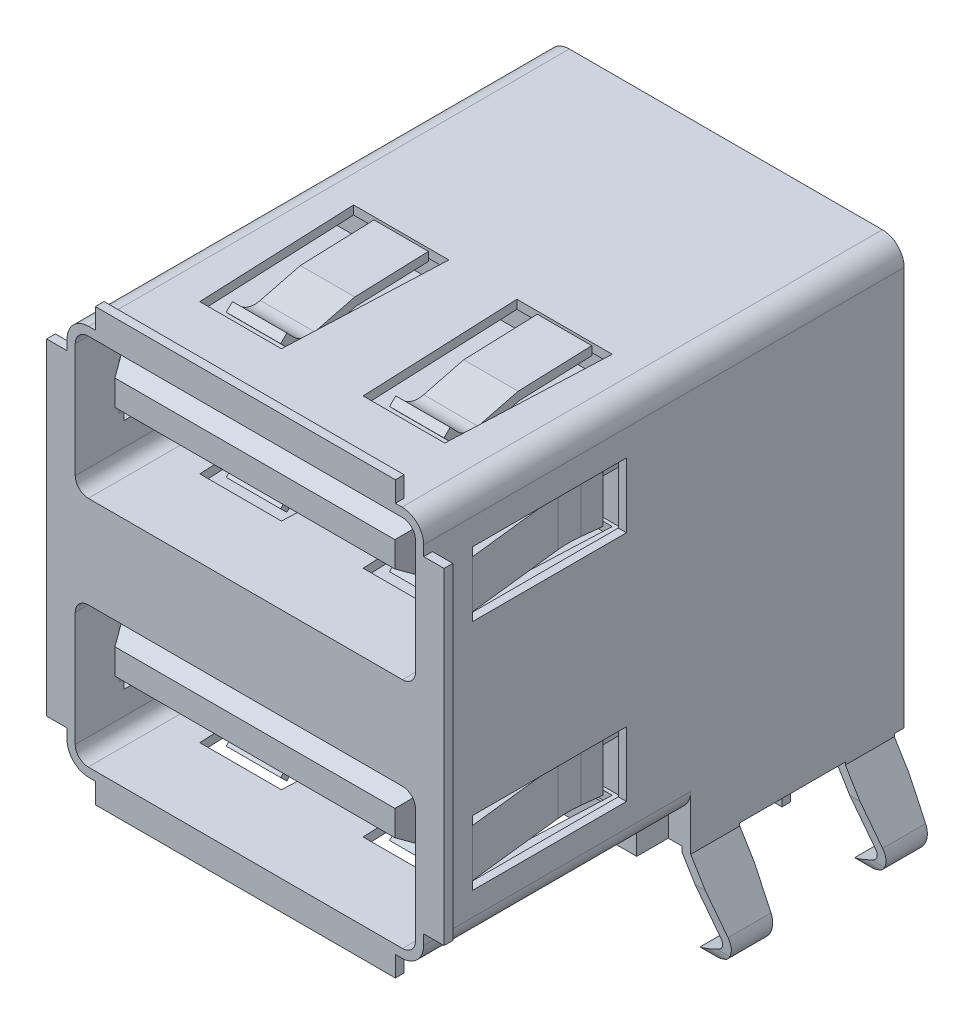
from build123d import *
from OCP.BRepFilletAPI import BRepFilletAPI_MakeChamfer

# Parameters (mm, degrees)
SKETCH1_W                                      = 13.1
SKETCH1_H                                      = 17.65
BASE_DEPTH                                     = 14.35
SKETCH3_W                                      = 11.02
SKETCH3_H                                      = 0.75
SKETCH3_W_2                                    = 0.75
SKETCH3_H_2                                    = 12
FRONT_TABS_DEPTH                               = 0.32
CORNER_FILLETS_R                               = 0.8
D_BACK_STEP_DEPTH                              = 7.84
SKETCH19_W                                     = 11.45
SKETCH19_H                                     = 1.16
D_BOTTOM_STEP_DEPTH                            = 1.1
GROUND_TAIL_1_DEPTH                            = 0.9
GROUND_TAIL_1_SHAPE_DEPTH                      = 8
GROUND_TAIL_PATTERN_COUNT                      = 2
GROUND_TAIL_PATTERN_PITCH                      = 5.68
SKETCH23_W                                     = 0.6604
SKETCH23_H                                     = 0.31
TH_CONTACT_TAIL_DEPTH                          = 4.1
TH_CONTACT_PATTERN_COUNT                       = 2
TH_CONTACT_PATTERN_PITCH                       = 2.62
CONTACT_AREA_CUTOUT_DEPTH                      = 8.85
TOP_BOTTOM_FLANGE_CUTOUT_DEPTH                 = 5.8
TOP_BOTTOM_FLANGE_DEPTH                        = 1
TOP_BOTTOM_FLANGE_PATTERN_COUNT                = 2
TOP_BOTTOM_FLANGE_PATTERN_PITCH                = 6
SKETCH14_W                                     = 5.65
SKETCH14_H                                     = 2.38
SIDE_FLANGE_CUTOUT_DEPTH                       = 23.686849228
SIDE_FLANGE_DEPTH                              = 0.875
SKETCH16_W                                     = 11.15
SKETCH16_H                                     = 1.8
CONTACT_GUIDE_DEPTH                            = 8.5
CONTACT_GUIDE_LEAD_IN_SIZE                     = 0.75
CONTACT_GUIDE_LEAD_IN_SIZE2                    = 0.433012702
CONTACT_DEPTH                                  = 0.33
CONTACT_PATTERN_COUNT                          = 2
CONTACT_PATTERN_PITCH                          = 2.5
CONTACT_PATTERN_MIRROR_COPY_1_DEPTH            = 0.33
TOP_USB_PATTERN_COUNT                          = 2
TOP_USB_PATTERN_PITCH                          = 8.55
TOP_USB_PATTERN_COPY_1_DEPTH                   = 1
TOP_USB_PATTERN_COPY_2_DEPTH                   = 0.33
TOP_USB_PATTERN_COPY_3_DEPTH                   = 0.33
TOP_USB_PATTERN_COPY_4_DEPTH                   = 0.33
CONTACT_GUIDE_LEAD_IN_OF_TOP_USB_PATTERN_SIZE  = 0.75
CONTACT_GUIDE_LEAD_IN_OF_TOP_USB_PATTERN_SIZE2 = 0.433012702


with BuildPart() as part:
    # Sketch1 → Base (new body)
    with BuildSketch(Plane(origin=(0, 0, 0), x_dir=(1, 0, 0), z_dir=(0, 1, 0))):
        Rectangle(SKETCH1_W, SKETCH1_H)
    extrude(amount=BASE_DEPTH)

    # Sketch3 → Front Tabs (add)
    with BuildSketch(Plane.XY.offset(8.825)):
        with Locations((0, 14.725)):
            Rectangle(SKETCH3_W, SKETCH3_H)
        with Locations((6.925, 7.175)):
            Rectangle(SKETCH3_W_2, SKETCH3_H_2)
        with Locations((0, -0.375)):
            Rectangle(SKETCH3_W, SKETCH3_H)
        with Locations((-6.925, 7.175)):
            Rectangle(SKETCH3_W_2, SKETCH3_H_2)
    extrude(amount=-FRONT_TABS_DEPTH)

    # Corner Fillets
    corner_fillets_edges = [part.edges().sort_by_distance(p)[0] for p in [
        (-6.55, 14.35, 0),
        (-6.55, 0, 0),
        (6.55, 0, 0),
        (6.55, 14.35, 0),
    ]]
    fillet(corner_fillets_edges, radius=CORNER_FILLETS_R)

    # Sketch18 → -D Back Step (add)
    with BuildSketch(Plane(origin=(0, 0, -8.825), x_dir=(-1, 0, 0), z_dir=(0, 0, -1))):
        with BuildLine():
            Line((-6.55, 0.8), (-6.55, -1.1))
            Line((-6.55, -1.1), (6.55, -1.1))
            Line((6.55, -1.1), (6.55, 0.8))
            ThreePointArc((6.55, 0.8), (6.315685425, 0.234314575), (5.75, 0))
            Line((5.75, 0), (-5.75, 0))
            ThreePointArc((-5.75, 0), (-6.315685425, 0.234314575), (-6.55, 0.8))
        make_face()
    extrude(amount=-D_BACK_STEP_DEPTH)

    # Sketch19 → -D Bottom Step (add)
    with BuildSketch(Plane.XZ):
        with Locations((0, -0.405)):
            Rectangle(SKETCH19_W, SKETCH19_H)
    extrude(amount=D_BOTTOM_STEP_DEPTH)

    # Sketch10 → Ground Tail 1 (add, symmetric)
    with BuildSketch(Plane.XY.offset(-1.885)):
        with BuildLine():
            Line((6.55, -1.2), (6.55, -1.1))
            Line((6.55, -1.1), (6.23, -1.1))
            Line((6.23, -1.1), (6.23, -1.289427281))
            Line((6.23, -1.289427281), (7.53653566, -3.444470404))
            ThreePointArc((7.53653566, -3.444470404), (7.568809506, -3.681173083), (7.417946806, -3.866403226))
            Line((7.417946806, -3.866403226), (6.55, -4.315836559))
            Line((6.55, -4.315836559), (6.69714326, -4.6))
            Line((6.69714326, -4.6), (7.565090066, -4.150566667))
            ThreePointArc((7.565090066, -4.150566667), (7.876872978, -3.767757706), (7.810173696, -3.278572167))
            Line((7.810173696, -3.278572167), (6.55, -1.2))
        make_face()
        with BuildLine():
            Line((-6.55, -1.1), (-6.23, -1.1))
            Line((-6.23, -1.1), (-6.23, -1.289427281))
            Line((-6.23, -1.289427281), (-7.53653566, -3.444470404))
            ThreePointArc((-7.53653566, -3.444470404), (-7.568809506, -3.681173083), (-7.417946806, -3.866403226))
            Line((-7.417946806, -3.866403226), (-6.55, -4.315836559))
            Line((-6.55, -4.315836559), (-6.69714326, -4.6))
            Line((-6.69714326, -4.6), (-7.565090066, -4.150566667))
            ThreePointArc((-7.565090066, -4.150566667), (-7.876872978, -3.767757706), (-7.810173696, -3.278572167))
            Line((-7.810173696, -3.278572167), (-6.55, -1.2))
            Line((-6.55, -1.2), (-6.55, -1.1))
        make_face()
    ground_tail_1 = extrude(amount=GROUND_TAIL_1_DEPTH, both=True)

    # Sketch11 → Ground Tail 1 Shape (cut, symmetric)
    with BuildSketch(Plane(origin=(0, 0, 0), x_dir=(0, 0, -1), z_dir=(1, 0, 0))):
        with BuildLine():
            Line((0.96, -1.809071665), (1.153297835, -3.906504778))
            ThreePointArc((1.153297835, -3.906504778), (1.885, -4.573874551), (2.616702165, -3.906504778))
            Line((2.616702165, -3.906504778), (2.81, -1.809071665))
            Line((2.81, -1.809071665), (2.81, -4.939071665))
            Line((2.81, -4.939071665), (0.96, -4.939071665))
            Line((0.96, -4.939071665), (0.96, -1.809071665))
        make_face()
    ground_tail_1_shape = extrude(amount=GROUND_TAIL_1_SHAPE_DEPTH, both=True, mode=Mode.SUBTRACT)

    # Ground Tail Pattern: Ground Tail 1, Ground Tail 1 Shape ×2
    with Locations(*[(0, 0, -i * GROUND_TAIL_PATTERN_PITCH) for i in range(1, GROUND_TAIL_PATTERN_COUNT)]):
        add(ground_tail_1)
        add(ground_tail_1_shape, mode=Mode.SUBTRACT)

    # Sketch23 → -TH Contact Tail (add)
    with BuildSketch(Plane.XZ):
        with Locations((-3.5098, -4.6028)):
            Rectangle(SKETCH23_W, SKETCH23_H)
        with Locations((3.4902, -4.6028)):
            Rectangle(SKETCH23_W, SKETCH23_H)
        with Locations((-1.0098, -4.6028)):
            Rectangle(SKETCH23_W, SKETCH23_H)
        with Locations((0.9902, -4.6028)):
            Rectangle(SKETCH23_W, SKETCH23_H)
    th_contact_tail = extrude(amount=TH_CONTACT_TAIL_DEPTH)

    # -TH Contact Pattern: -TH Contact Tail ×2
    with Locations(*[(0, 0, -i * TH_CONTACT_PATTERN_PITCH) for i in range(1, TH_CONTACT_PATTERN_COUNT)]):
        add(th_contact_tail)

    # Sketch8 → Contact Area Cutout (cut)
    with BuildSketch(Plane.XY.offset(8.825)):
        with BuildLine():
            Line((-6.25, 5), (-6.25, 0.8))
            ThreePointArc((-6.25, 0.8), (-6.109411255, 0.460588745), (-5.77, 0.32))
            Line((-5.77, 0.32), (5.77, 0.32))
            ThreePointArc((5.77, 0.32), (6.109411255, 0.460588745), (6.25, 0.8))
            Line((6.25, 0.8), (6.25, 5))
            ThreePointArc((6.25, 5), (6.109411255, 5.339411255), (5.77, 5.48))
            Line((5.77, 5.48), (-5.77, 5.48))
            ThreePointArc((-5.77, 5.48), (-6.109411255, 5.339411255), (-6.25, 5))
        make_face()
    contact_area_cutout = extrude(amount=-CONTACT_AREA_CUTOUT_DEPTH, mode=Mode.SUBTRACT)

    # Sketch12 → Top/Bottom Flange Cutout (cut)
    with BuildSketch(Plane(origin=(0, 0, 0), x_dir=(-1, 0, 0), z_dir=(0, 1, 0))):
        Polygon((4.5, 6), (4.75, 0.1), (1.25, 0.1), (1.5, 6), align=None)
        Polygon((-4.75, 0.1), (-1.25, 0.1), (-1.5, 6), (-4.5, 6), align=None)
    top_bottom_flange_cutout = extrude(amount=TOP_BOTTOM_FLANGE_CUTOUT_DEPTH, mode=Mode.SUBTRACT)

    # Sketch13 → Top/Bottom Flange (add, symmetric)
    with BuildSketch(Plane(origin=(-3, 0, 0), x_dir=(0, 0, -1), z_dir=(1, 0, 0))):
        with BuildLine():
            Line((-2.760063847, 0.417489088), (-4.198269078, 0.784212886))
            ThreePointArc((-4.198269078, 0.784212886), (-4.778069903, 0.777154214), (-5.276638422, 0.481099735))
            Line((-5.276638422, 0.481099735), (-5.529039549, 0.222413302))
            Line((-5.529039549, 0.222413302), (-5.3, -0.001061272))
            Line((-5.3, -0.001061272), (-5.047598873, 0.257625162))
            ThreePointArc((-5.047598873, 0.257625162), (-4.691478502, 0.469092647), (-4.277335056, 0.474134555))
            Line((-4.277335056, 0.474134555), (-2.8059045, 0.098938728))
            Line((-2.8059045, 0.098938728), (-0.1, 0.001))
            Line((-0.1, 0.001), (-0.1, 0.321209538))
            Line((-0.1, 0.321209538), (-2.760063847, 0.417489088))
        make_face()
        with BuildLine():
            Line((-2.8059045, 5.601061272), (-4.277335056, 5.225865445))
            ThreePointArc((-4.277335056, 5.225865445), (-4.691478502, 5.230907353), (-5.047598873, 5.442374838))
            Line((-5.047598873, 5.442374838), (-5.3, 5.701061272))
            Line((-5.3, 5.701061272), (-5.529039549, 5.477586698))
            Line((-5.529039549, 5.477586698), (-5.276638422, 5.218900265))
            ThreePointArc((-5.276638422, 5.218900265), (-4.778069903, 4.922845786), (-4.198269078, 4.915787114))
            Line((-4.198269078, 4.915787114), (-2.760063847, 5.282510912))
            Line((-2.760063847, 5.282510912), (-0.1, 5.378790462))
            Line((-0.1, 5.378790462), (-0.1, 5.699))
            Line((-0.1, 5.699), (-2.8059045, 5.601061272))
        make_face()
    top_bottom_flange = extrude(amount=TOP_BOTTOM_FLANGE_DEPTH, both=True)

    # Top/Bottom Flange Pattern: Top/Bottom Flange ×2
    with Locations(*[(i * TOP_BOTTOM_FLANGE_PATTERN_PITCH, 0, 0) for i in range(1, TOP_BOTTOM_FLANGE_PATTERN_COUNT)]):
        add(top_bottom_flange)

    # Sketch14 → Side Flange Cutout (cut, through all)
    with BuildSketch(Plane(origin=(6.55, 0, 0), x_dir=(0, 0, -1), z_dir=(1, 0, 0))):
        with Locations((-4.2, 2.85)):
            Rectangle(SKETCH14_W, SKETCH14_H)
    side_flange_cutout = extrude(amount=-SIDE_FLANGE_CUTOUT_DEPTH, mode=Mode.SUBTRACT)

    # Sketch15 → Side Flange (add, symmetric)
    with BuildSketch(Plane(origin=(0, 2.85, 0), x_dir=(-1, 0, 0), z_dir=(0, 1, 0))):
        with BuildLine():
            Line((6.55, 7.025), (6.149012428, 3.498694006))
            ThreePointArc((6.149012428, 3.498694006), (6.125000079, 3.075770202), (6.148838699, 2.65283657))
            Line((6.148838699, 2.65283657), (6.231300503, 1.925))
            Line((6.231300503, 1.925), (5.913334739, 1.888975387))
            Line((5.913334739, 1.888975387), (5.830872935, 2.616811958))
            ThreePointArc((5.830872935, 2.616811958), (5.805000086, 3.075835926), (5.831061488, 3.534849227))
            Line((5.831061488, 3.534849227), (6.25, 7.219016737))
            Line((6.25, 7.219016737), (6.55, 7.025))
        make_face()
        with BuildLine():
            Line((-5.913334739, 1.888975387), (-6.231300503, 1.925))
            Line((-6.231300503, 1.925), (-6.148838699, 2.65283657))
            ThreePointArc((-6.148838699, 2.65283657), (-6.125000079, 3.075770202), (-6.149012428, 3.498694006))
            Line((-6.149012428, 3.498694006), (-6.55, 7.025))
            Line((-6.55, 7.025), (-6.25, 7.219016737))
            Line((-6.25, 7.219016737), (-5.831061488, 3.534849227))
            ThreePointArc((-5.831061488, 3.534849227), (-5.805000086, 3.075835926), (-5.830872935, 2.616811958))
            Line((-5.830872935, 2.616811958), (-5.913334739, 1.888975387))
        make_face()
    side_flange = extrude(amount=SIDE_FLANGE_DEPTH, both=True)

    # Sketch16 → Contact Guide (add)
    with BuildSketch(Plane.XY.offset(-0.025)):
        with Locations((0, 3.82)):
            Rectangle(SKETCH16_W, SKETCH16_H)
    contact_guide = extrude(amount=CONTACT_GUIDE_DEPTH)

    # Contact Guide Lead-in: one chamfer whose edges measure the first distance from different faces: ONE call of the kernel's chamfer builder (chamfer() names one face for all edges)
    contact_guide_lead_in_edges_1 = [part.edges().sort_by_distance(p)[0] for p in [
        (5.575, 3.82, 8.475),
    ]]
    contact_guide_lead_in_side_1 = [part.faces().sort_by_distance(p)[0] for p in [
        (5.575, 3.82, 4.225),
    ]]
    contact_guide_lead_in_edges_2 = [part.edges().sort_by_distance(p)[0] for p in [
        (0, 4.72, 8.475),
    ]]
    contact_guide_lead_in_side_2 = [part.faces().sort_by_distance(p)[0] for p in [
        (0, 4.72, 4.225),
    ]]
    contact_guide_lead_in_edges_3 = [part.edges().sort_by_distance(p)[0] for p in [
        (-5.575, 3.82, 8.475),
    ]]
    contact_guide_lead_in_side_3 = [part.faces().sort_by_distance(p)[0] for p in [
        (-5.575, 3.82, 4.225),
    ]]
    contact_guide_lead_in_edges_4 = [part.edges().sort_by_distance(p)[0] for p in [
        (0, 2.92, 8.475),
    ]]
    contact_guide_lead_in_side_4 = [part.faces().sort_by_distance(p)[0] for p in [
        (0, 2.92, 4.225),
    ]]
    contact_guide_lead_in = BRepFilletAPI_MakeChamfer(part.part.solid().wrapped)
    for e in contact_guide_lead_in_edges_1:
        contact_guide_lead_in.Add(CONTACT_GUIDE_LEAD_IN_SIZE, CONTACT_GUIDE_LEAD_IN_SIZE2, e.wrapped, contact_guide_lead_in_side_1[0].wrapped)  # the first distance lies on this face
    for e in contact_guide_lead_in_edges_2:
        contact_guide_lead_in.Add(CONTACT_GUIDE_LEAD_IN_SIZE, CONTACT_GUIDE_LEAD_IN_SIZE2, e.wrapped, contact_guide_lead_in_side_2[0].wrapped)  # the first distance lies on this face
    for e in contact_guide_lead_in_edges_3:
        contact_guide_lead_in.Add(CONTACT_GUIDE_LEAD_IN_SIZE, CONTACT_GUIDE_LEAD_IN_SIZE2, e.wrapped, contact_guide_lead_in_side_3[0].wrapped)  # the first distance lies on this face
    for e in contact_guide_lead_in_edges_4:
        contact_guide_lead_in.Add(CONTACT_GUIDE_LEAD_IN_SIZE, CONTACT_GUIDE_LEAD_IN_SIZE2, e.wrapped, contact_guide_lead_in_side_4[0].wrapped)  # the first distance lies on this face
    add(Compound.cast(contact_guide_lead_in.Shape()), mode=Mode.REPLACE)

    # Sketch17 → Contact (add, symmetric)
    with BuildSketch(Plane(origin=(-3.5, 0, 0), x_dir=(0, 0, -1), z_dir=(1, 0, 0))):
        with BuildLine():
            Line((0.025, 3.91), (0.025, 3.65))
            Line((0.025, 3.65), (-1.225, 3.65))
            Line((-1.225, 3.65), (-4.787949724, 2.507463672))
            ThreePointArc((-4.787949724, 2.507463672), (-5.767552697, 2.419100424), (-6.691249642, 2.757056047))
            Line((-6.691249642, 2.757056047), (-7.225, 3.1))
            Line((-7.225, 3.1), (-7.084455597, 3.31874019))
            Line((-7.084455597, 3.31874019), (-6.550705239, 2.975796237))
            ThreePointArc((-6.550705239, 2.975796237), (-5.733746608, 2.676893264), (-4.867342201, 2.755045647))
            Line((-4.867342201, 2.755045647), (-1.265667409, 3.91))
            Line((-1.265667409, 3.91), (0.025, 3.91))
        make_face()
    contact = extrude(amount=CONTACT_DEPTH, both=True)

    # Contact Pattern: Contact ×2
    with Locations(*[(i * CONTACT_PATTERN_PITCH, 0, 0) for i in range(1, CONTACT_PATTERN_COUNT)]):
        add(contact)

    # Contact Pattern Mirror: Contact across plane
    add(contact.mirror(Plane(origin=(0, 0, 0), x_dir=(0, 0, 1), z_dir=(1, 0, 0))))

    # Contact Pattern Mirror copy 1 sketch → Contact Pattern Mirror copy 1 (add, symmetric)
    with BuildSketch(Plane(origin=(1, 0, 0), x_dir=(0, 0, -1), z_dir=(-1, 0, 0))):
        with BuildLine():
            Line((0.025, -3.91), (0.025, -3.65))
            Line((0.025, -3.65), (-1.225, -3.65))
            Line((-1.225, -3.65), (-4.787949724, -2.507463672))
            ThreePointArc((-4.787949724, -2.507463672), (-5.767552697, -2.419100424), (-6.691249642, -2.757056047))
            Line((-6.691249642, -2.757056047), (-7.225, -3.1))
            Line((-7.225, -3.1), (-7.084455597, -3.31874019))
            Line((-7.084455597, -3.31874019), (-6.550705239, -2.975796237))
            ThreePointArc((-6.550705239, -2.975796237), (-5.733746608, -2.676893264), (-4.867342201, -2.755045647))
            Line((-4.867342201, -2.755045647), (-1.265667409, -3.91))
            Line((-1.265667409, -3.91), (0.025, -3.91))
        make_face()
    extrude(amount=CONTACT_PATTERN_MIRROR_COPY_1_DEPTH, both=True)

    # Top USB Pattern: Contact Area Cutout, Top/Bottom Flange Cutout, Top/Bottom Flange, Side Flange Cutout, Side Flange, Contact Guide, Contact ×2
    with Locations(*[(0, i * TOP_USB_PATTERN_PITCH, 0) for i in range(1, TOP_USB_PATTERN_COUNT)]):
        add(contact_area_cutout, mode=Mode.SUBTRACT)
        add(top_bottom_flange_cutout, mode=Mode.SUBTRACT)
        add(top_bottom_flange)
        add(side_flange_cutout, mode=Mode.SUBTRACT)
        add(side_flange)
        add(contact_guide)
        add(contact)

    # Top USB Pattern copy 1 sketch → Top USB Pattern copy 1 (add, symmetric)
    with BuildSketch(Plane(origin=(3, 8.55, 0), x_dir=(0, 0, -1), z_dir=(1, 0, 0))):
        with BuildLine():
            Line((-2.760063847, 0.417489088), (-4.198269078, 0.784212886))
            ThreePointArc((-4.198269078, 0.784212886), (-4.778069903, 0.777154214), (-5.276638422, 0.481099735))
            Line((-5.276638422, 0.481099735), (-5.529039549, 0.222413302))
            Line((-5.529039549, 0.222413302), (-5.3, -0.001061272))
            Line((-5.3, -0.001061272), (-5.047598873, 0.257625162))
            ThreePointArc((-5.047598873, 0.257625162), (-4.691478502, 0.469092647), (-4.277335056, 0.474134555))
            Line((-4.277335056, 0.474134555), (-2.8059045, 0.098938728))
            Line((-2.8059045, 0.098938728), (-0.1, 0.001))
            Line((-0.1, 0.001), (-0.1, 0.321209538))
            Line((-0.1, 0.321209538), (-2.760063847, 0.417489088))
        make_face()
        with BuildLine():
            Line((-2.8059045, 5.601061272), (-4.277335056, 5.225865445))
            ThreePointArc((-4.277335056, 5.225865445), (-4.691478502, 5.230907353), (-5.047598873, 5.442374838))
            Line((-5.047598873, 5.442374838), (-5.3, 5.701061272))
            Line((-5.3, 5.701061272), (-5.529039549, 5.477586698))
            Line((-5.529039549, 5.477586698), (-5.276638422, 5.218900265))
            ThreePointArc((-5.276638422, 5.218900265), (-4.778069903, 4.922845786), (-4.198269078, 4.915787114))
            Line((-4.198269078, 4.915787114), (-2.760063847, 5.282510912))
            Line((-2.760063847, 5.282510912), (-0.1, 5.378790462))
            Line((-0.1, 5.378790462), (-0.1, 5.699))
            Line((-0.1, 5.699), (-2.8059045, 5.601061272))
        make_face()
    extrude(amount=TOP_USB_PATTERN_COPY_1_DEPTH, both=True)

    # Top USB Pattern copy 2 sketch → Top USB Pattern copy 2 (add, symmetric)
    with BuildSketch(Plane(origin=(-1, 8.55, 0), x_dir=(0, 0, -1), z_dir=(1, 0, 0))):
        with BuildLine():
            Line((0.025, 3.91), (0.025, 3.65))
            Line((0.025, 3.65), (-1.225, 3.65))
            Line((-1.225, 3.65), (-4.787949724, 2.507463672))
            ThreePointArc((-4.787949724, 2.507463672), (-5.767552697, 2.419100424), (-6.691249642, 2.757056047))
            Line((-6.691249642, 2.757056047), (-7.225, 3.1))
            Line((-7.225, 3.1), (-7.084455597, 3.31874019))
            Line((-7.084455597, 3.31874019), (-6.550705239, 2.975796237))
            ThreePointArc((-6.550705239, 2.975796237), (-5.733746608, 2.676893264), (-4.867342201, 2.755045647))
            Line((-4.867342201, 2.755045647), (-1.265667409, 3.91))
            Line((-1.265667409, 3.91), (0.025, 3.91))
        make_face()
    extrude(amount=TOP_USB_PATTERN_COPY_2_DEPTH, both=True)

    # Top USB Pattern copy 3 sketch → Top USB Pattern copy 3 (add, symmetric)
    with BuildSketch(Plane(origin=(3.5, 8.55, 0), x_dir=(0, 0, -1), z_dir=(-1, 0, 0))):
        with BuildLine():
            Line((0.025, -3.91), (0.025, -3.65))
            Line((0.025, -3.65), (-1.225, -3.65))
            Line((-1.225, -3.65), (-4.787949724, -2.507463672))
            ThreePointArc((-4.787949724, -2.507463672), (-5.767552697, -2.419100424), (-6.691249642, -2.757056047))
            Line((-6.691249642, -2.757056047), (-7.225, -3.1))
            Line((-7.225, -3.1), (-7.084455597, -3.31874019))
            Line((-7.084455597, -3.31874019), (-6.550705239, -2.975796237))
            ThreePointArc((-6.550705239, -2.975796237), (-5.733746608, -2.676893264), (-4.867342201, -2.755045647))
            Line((-4.867342201, -2.755045647), (-1.265667409, -3.91))
            Line((-1.265667409, -3.91), (0.025, -3.91))
        make_face()
    extrude(amount=TOP_USB_PATTERN_COPY_3_DEPTH, both=True)

    # Top USB Pattern copy 4 sketch → Top USB Pattern copy 4 (add, symmetric)
    with BuildSketch(Plane(origin=(1, 8.55, 0), x_dir=(0, 0, -1), z_dir=(-1, 0, 0))):
        with BuildLine():
            Line((0.025, -3.91), (0.025, -3.65))
            Line((0.025, -3.65), (-1.225, -3.65))
            Line((-1.225, -3.65), (-4.787949724, -2.507463672))
            ThreePointArc((-4.787949724, -2.507463672), (-5.767552697, -2.419100424), (-6.691249642, -2.757056047))
            Line((-6.691249642, -2.757056047), (-7.225, -3.1))
            Line((-7.225, -3.1), (-7.084455597, -3.31874019))
            Line((-7.084455597, -3.31874019), (-6.550705239, -2.975796237))
            ThreePointArc((-6.550705239, -2.975796237), (-5.733746608, -2.676893264), (-4.867342201, -2.755045647))
            Line((-4.867342201, -2.755045647), (-1.265667409, -3.91))
            Line((-1.265667409, -3.91), (0.025, -3.91))
        make_face()
    extrude(amount=TOP_USB_PATTERN_COPY_4_DEPTH, both=True)

    # Contact Guide Lead-in of Top USB Pattern: one chamfer whose edges measure the first distance from different faces: ONE call of the kernel's chamfer builder (chamfer() names one face for all edges)
    contact_guide_lead_in_of_top_usb_pattern_edges_1 = [part.edges().sort_by_distance(p)[0] for p in [
        (5.575, 12.37, 8.475),
    ]]
    contact_guide_lead_in_of_top_usb_pattern_side_1 = [part.faces().sort_by_distance(p)[0] for p in [
        (5.575, 12.37, 4.225),
    ]]
    contact_guide_lead_in_of_top_usb_pattern_edges_2 = [part.edges().sort_by_distance(p)[0] for p in [
        (0, 13.27, 8.475),
    ]]
    contact_guide_lead_in_of_top_usb_pattern_side_2 = [part.faces().sort_by_distance(p)[0] for p in [
        (0, 13.27, 4.225),
    ]]
    contact_guide_lead_in_of_top_usb_pattern_edges_3 = [part.edges().sort_by_distance(p)[0] for p in [
        (-5.575, 12.37, 8.475),
    ]]
    contact_guide_lead_in_of_top_usb_pattern_side_3 = [part.faces().sort_by_distance(p)[0] for p in [
        (-5.575, 12.37, 4.225),
    ]]
    contact_guide_lead_in_of_top_usb_pattern_edges_4 = [part.edges().sort_by_distance(p)[0] for p in [
        (0, 11.47, 8.475),
    ]]
    contact_guide_lead_in_of_top_usb_pattern_side_4 = [part.faces().sort_by_distance(p)[0] for p in [
        (0, 11.47, 4.225),
    ]]
    contact_guide_lead_in_of_top_usb_pattern = BRepFilletAPI_MakeChamfer(part.part.solid().wrapped)
    for e in contact_guide_lead_in_of_top_usb_pattern_edges_1:
        contact_guide_lead_in_of_top_usb_pattern.Add(CONTACT_GUIDE_LEAD_IN_OF_TOP_USB_PATTERN_SIZE, CONTACT_GUIDE_LEAD_IN_OF_TOP_USB_PATTERN_SIZE2, e.wrapped, contact_guide_lead_in_of_top_usb_pattern_side_1[0].wrapped)  # the first distance lies on this face
    for e in contact_guide_lead_in_of_top_usb_pattern_edges_2:
        contact_guide_lead_in_of_top_usb_pattern.Add(CONTACT_GUIDE_LEAD_IN_OF_TOP_USB_PATTERN_SIZE, CONTACT_GUIDE_LEAD_IN_OF_TOP_USB_PATTERN_SIZE2, e.wrapped, contact_guide_lead_in_of_top_usb_pattern_side_2[0].wrapped)  # the first distance lies on this face
    for e in contact_guide_lead_in_of_top_usb_pattern_edges_3:
        contact_guide_lead_in_of_top_usb_pattern.Add(CONTACT_GUIDE_LEAD_IN_OF_TOP_USB_PATTERN_SIZE, CONTACT_GUIDE_LEAD_IN_OF_TOP_USB_PATTERN_SIZE2, e.wrapped, contact_guide_lead_in_of_top_usb_pattern_side_3[0].wrapped)  # the first distance lies on this face
    for e in contact_guide_lead_in_of_top_usb_pattern_edges_4:
        contact_guide_lead_in_of_top_usb_pattern.Add(CONTACT_GUIDE_LEAD_IN_OF_TOP_USB_PATTERN_SIZE, CONTACT_GUIDE_LEAD_IN_OF_TOP_USB_PATTERN_SIZE2, e.wrapped, contact_guide_lead_in_of_top_usb_pattern_side_4[0].wrapped)  # the first distance lies on this face
    add(Compound.cast(contact_guide_lead_in_of_top_usb_pattern.Shape()), mode=Mode.REPLACE)


solid = part.part
